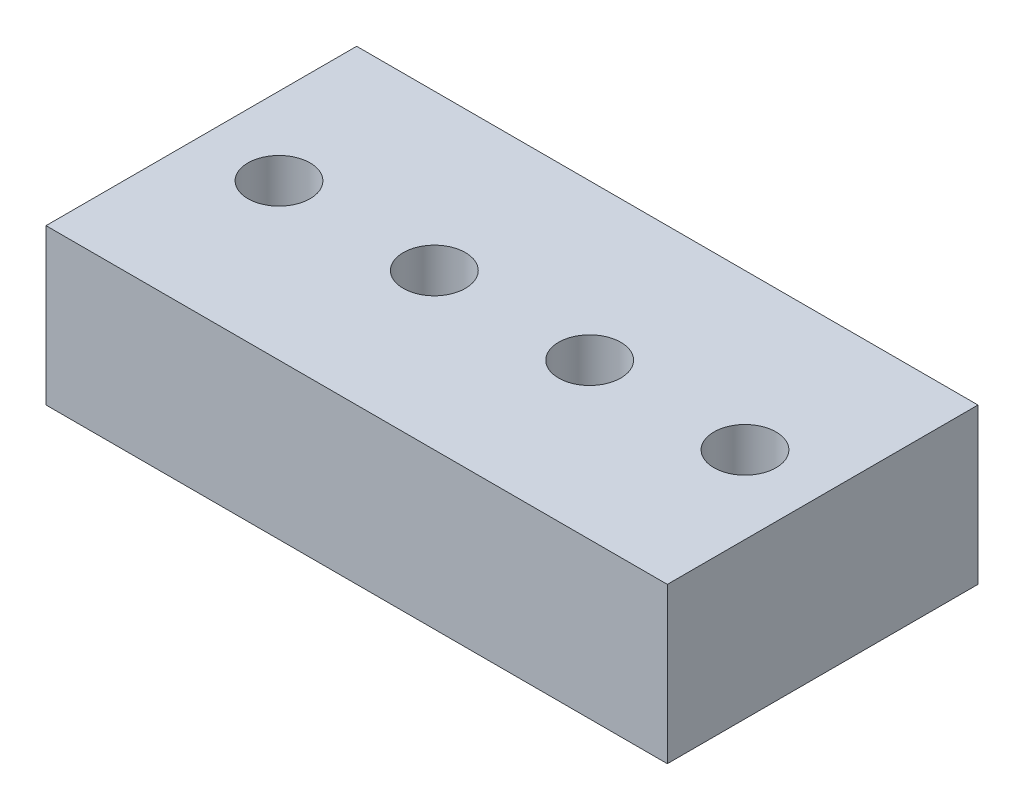
from build123d import *

# Parameters (mm, degrees)
SKETCH1_W           = 80
SKETCH1_H           = 40
BOSS_EXTRUDE1_DEPTH = 20
SKETCH2_R           = 4
CUT_EXTRUDE1_DEPTH  = 49.989794856
LPATTERN1_COUNT     = 4
LPATTERN1_PITCH     = 20


with BuildPart() as part:
    # Sketch1 → Boss-Extrude1 (new body)
    with BuildSketch(Plane(origin=(0, 0, 0), x_dir=(1, 0, 0), z_dir=(0, 1, 0))):
        Rectangle(SKETCH1_W, SKETCH1_H)
    extrude(amount=BOSS_EXTRUDE1_DEPTH)

    # Sketch2 → Cut-Extrude1 (cut, through all)
    with BuildSketch(Plane(origin=(0, 20, 0), x_dir=(1, 0, 0), z_dir=(0, 1, 0))):
        with Locations(Location((-30, 0, 0), (0, 0, 270))):
            Circle(SKETCH2_R)
    cut_extrude1 = extrude(amount=-CUT_EXTRUDE1_DEPTH, mode=Mode.SUBTRACT)

    # LPattern1: Cut-Extrude1 ×4
    with Locations(*[(i * LPATTERN1_PITCH, 0, 0) for i in range(1, LPATTERN1_COUNT)]):
        add(cut_extrude1, mode=Mode.SUBTRACT)


solid = part.part
